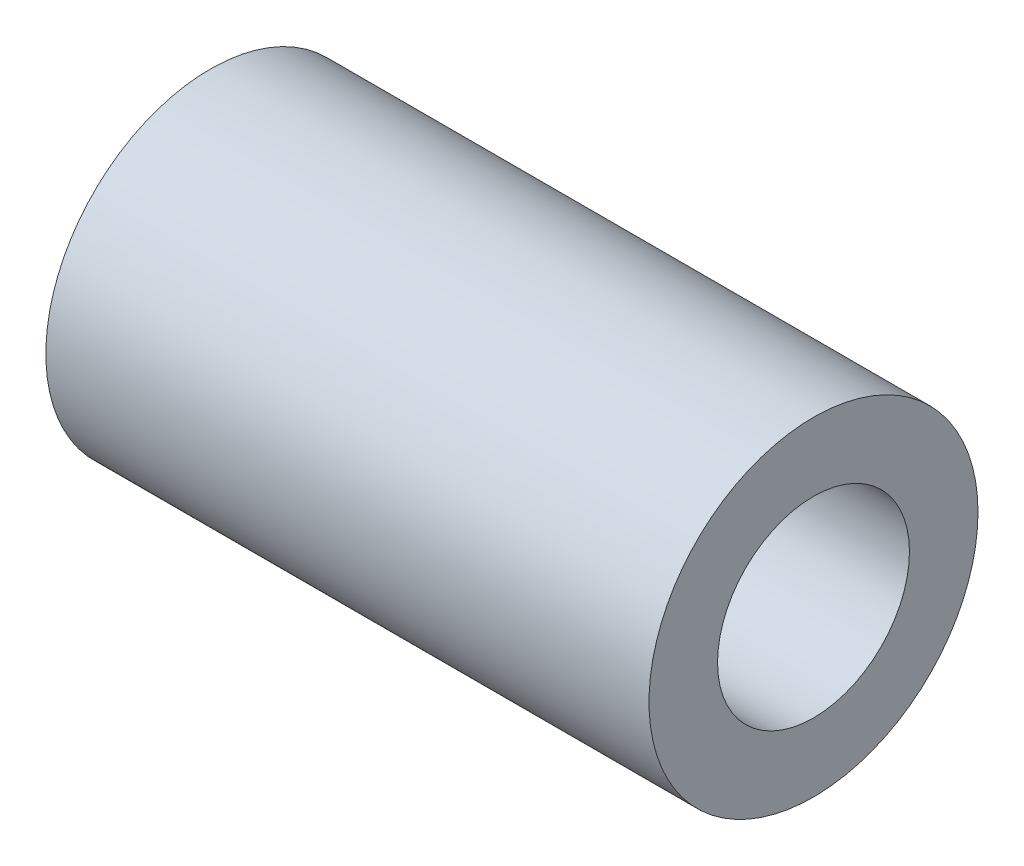
from build123d import *

# Parameters (mm, degrees)
CROQUIS1_R              = 3
CROQUIS1_R_2            = 1.75
SALIENTE_EXTRUIR1_DEPTH = 5.5


with BuildPart() as part:
    # Croquis1 → Saliente-Extruir1 (new, symmetric)
    with BuildSketch(Plane(origin=(0, 0, 0), x_dir=(0, 0, -1), z_dir=(1, 0, 0))):
        Circle(CROQUIS1_R)
        Circle(CROQUIS1_R_2, mode=Mode.SUBTRACT)
    extrude(amount=SALIENTE_EXTRUIR1_DEPTH, both=True)


solid = part.part
